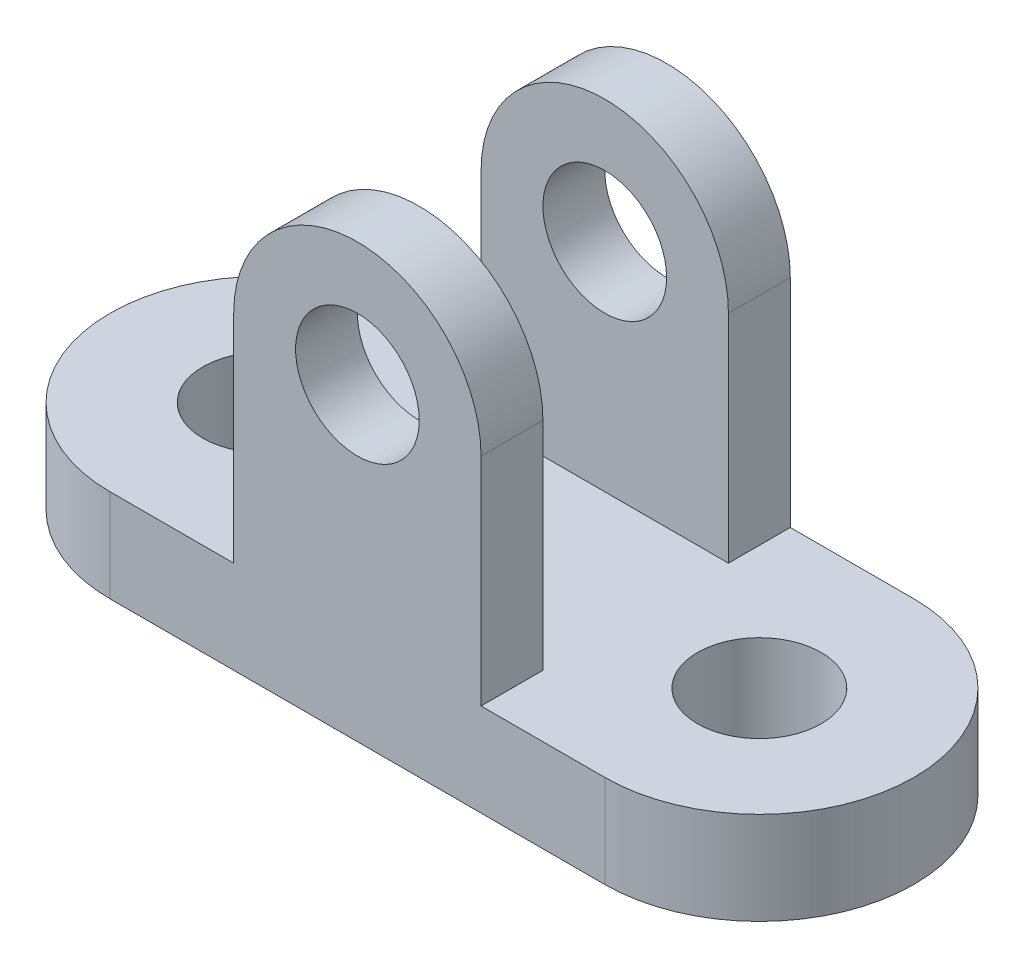
from build123d import *

# Parameters (mm, degrees)
SKETCH2_R           = 10
BOSS_EXTRUDE1_DEPTH = 15
BOSS_EXTRUDE2_START = 15
SKETCH3_R           = 10
BOSS_EXTRUDE2_DEPTH = 10


with BuildPart() as part:
    # Sketch2 → Boss-Extrude1 (new body)
    with BuildSketch(Plane(origin=(0, 0, 0), x_dir=(1, 0, 0), z_dir=(0, 1, 0))):
        with BuildLine():
            Line((-40, 25), (40, 25))
            ThreePointArc((40, 25), (65, 0), (40, -25))
            Line((40, -25), (-40, -25))
            ThreePointArc((-40, -25), (-65, 0), (-40, 25))
        make_face()
        with Locations(Location((-40, 0, 0), (0, 0, 270))):
            Circle(SKETCH2_R, mode=Mode.SUBTRACT)
        with Locations(Location((40, 0, 0), (0, 0, 270))):
            Circle(SKETCH2_R, mode=Mode.SUBTRACT)
    extrude(amount=BOSS_EXTRUDE1_DEPTH)

    # Sketch3 → Boss-Extrude2 (add)
    with BuildSketch(Plane.XY.offset(BOSS_EXTRUDE2_START)):
        with BuildLine():
            Line((-20, 15), (-20, 50))
            ThreePointArc((-20, 50), (0, 70), (20, 50))
            Line((20, 50), (20, 15))
            Line((20, 15), (-20, 15))
        make_face()
        with Locations((0, 50)):
            Circle(SKETCH3_R, mode=Mode.SUBTRACT)
    boss_extrude2 = extrude(amount=BOSS_EXTRUDE2_DEPTH)

    # Mirror1: Boss-Extrude2 across plane
    add(boss_extrude2.mirror(Plane.XY))


solid = part.part
